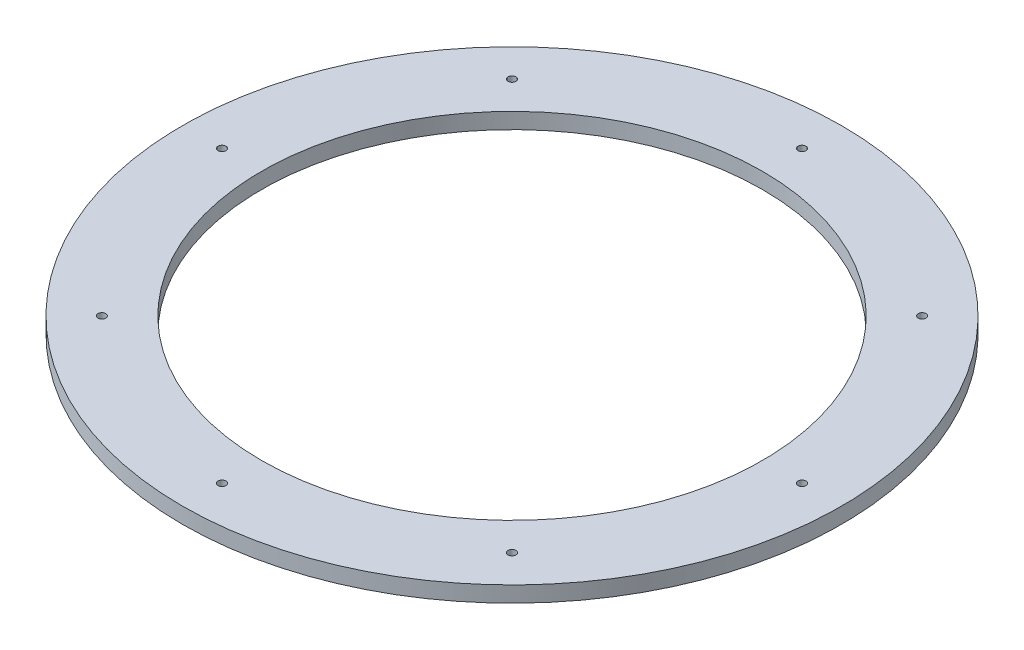
from build123d import *

# Parameters (mm, degrees)
SKETCH1_R           = 125
SKETCH1_R_2         = 1.5
SKETCH1_R_3         = 95
BOSS_EXTRUDE1_DEPTH = 6


with BuildPart() as part:
    # Sketch1 → Boss-Extrude1 (new body)
    with BuildSketch(Plane(origin=(0, 0, 0), x_dir=(1, 0, 0), z_dir=(0, 1, 0))):
        Circle(SKETCH1_R)
        with Locations((0, -110)):
            Circle(SKETCH1_R_2, mode=Mode.SUBTRACT)
        with Locations((77.781745931, -77.781745931)):
            Circle(SKETCH1_R_2, mode=Mode.SUBTRACT)
        with Locations((110, 0)):
            Circle(SKETCH1_R_2, mode=Mode.SUBTRACT)
        with Locations((77.781745931, 77.781745931)):
            Circle(SKETCH1_R_2, mode=Mode.SUBTRACT)
        with Locations((0, 110)):
            Circle(SKETCH1_R_2, mode=Mode.SUBTRACT)
        with Locations((-77.781745931, 77.781745931)):
            Circle(SKETCH1_R_2, mode=Mode.SUBTRACT)
        with Locations((-110, 0)):
            Circle(SKETCH1_R_2, mode=Mode.SUBTRACT)
        with Locations((-77.781745931, -77.781745931)):
            Circle(SKETCH1_R_2, mode=Mode.SUBTRACT)
        Circle(SKETCH1_R_3, mode=Mode.SUBTRACT)
    extrude(amount=BOSS_EXTRUDE1_DEPTH)


solid = part.part
